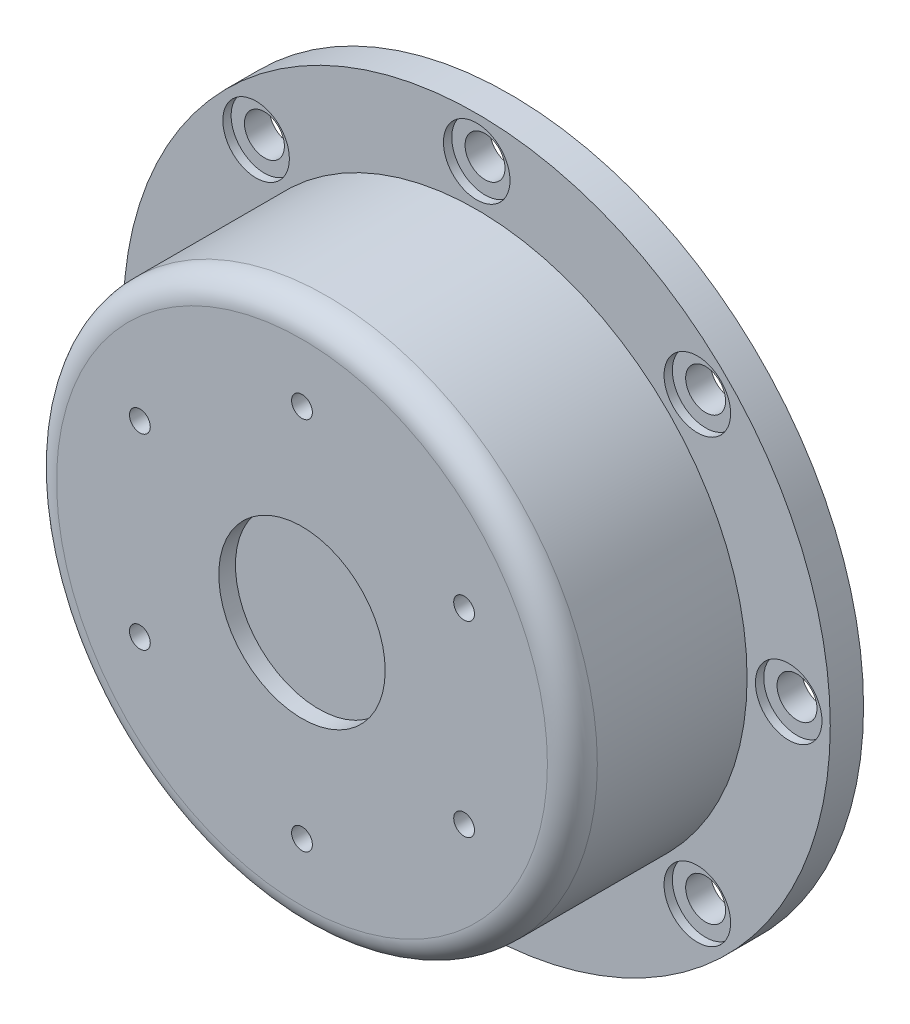
from build123d import *

# Parameters (mm, degrees)
SKETCH_1_R               = 42.5
EXTRUDE_1_DEPTH          = 25
SKETCH_2_OUTSIDE_W       = 111.556
SKETCH_2_OUTSIDE_H       = 111.556
SKETCH_2_OUTSIDE_R       = 32.5
CUT_EXTRUDE_1_DEPTH      = 21
PATTERN_CIRCULAR_1_COUNT = 8
SKETCH_5_R               = 10
CUT_EXTRUDE_2_DEPTH      = 2
PATTERN_CIRCULAR_2_COUNT = 6
FILLET_1_R               = 3


with BuildPart() as part:
    # 草图1 → 凸台-拉伸1 (new body)
    with BuildSketch(Plane.XY):
        Circle(SKETCH_1_R)
    extrude(amount=EXTRUDE_1_DEPTH)

    # 草图2 outside → 切除-拉伸1 (cut)
    with BuildSketch(Plane.XY.offset(25)):
        Rectangle(SKETCH_2_OUTSIDE_W, SKETCH_2_OUTSIDE_H)
        Circle(SKETCH_2_OUTSIDE_R, mode=Mode.SUBTRACT)
    extrude(amount=-CUT_EXTRUDE_1_DEPTH, mode=Mode.SUBTRACT)

    # 草图3 → 打孔尺寸(%根据)内六角圆柱头螺钉的类型1 (revolve, cut)
    with BuildSketch(Plane(origin=(0, 37.5, 4), x_dir=(0, -1, 0), z_dir=(1, 0, 0))):
        Polygon((0, 0), (0, 7.942065486), (2.4, 6.5), (2.4, 1), (4, 1), (4, 0), align=None)
    hole_wizard_1 = revolve(axis=Axis((0, 37.5, 10.35), (0, 0, -1)), mode=Mode.SUBTRACT)

    # 阵列(圆周)1: 打孔尺寸(%根据)内六角圆柱头螺钉的类型1 ×8 about axis
    pattern_circular_1_axis = Axis((0, 0, 0), (0, 0, 1))
    for i in range(1, PATTERN_CIRCULAR_1_COUNT):
        add(hole_wizard_1.rotate(pattern_circular_1_axis, i * 360 / PATTERN_CIRCULAR_1_COUNT), mode=Mode.SUBTRACT)

    # 草图5 → 切除-拉伸2 (cut)
    with BuildSketch(Plane.XY.offset(25)):
        Circle(SKETCH_5_R)
    extrude(amount=-CUT_EXTRUDE_2_DEPTH, mode=Mode.SUBTRACT)

    # 草图6 → M3 螺纹孔1 (revolve, cut)
    with BuildSketch(Plane(origin=(0, 22.5, 25), x_dir=(0, -1, 0), z_dir=(1, 0, 0))):
        Polygon((0, 0), (0, 7.251075774), (1.25, 6.5), (1.25, 0), align=None)
    hole_wizard_m3_1 = revolve(axis=Axis((0, 22.5, 31.35), (0, 0, -1)), mode=Mode.SUBTRACT)

    # 阵列(圆周)2: M3 螺纹孔1 ×6 about axis
    pattern_circular_2_axis = Axis((0, 0, 0), (0, 0, 1))
    for i in range(1, PATTERN_CIRCULAR_2_COUNT):
        add(hole_wizard_m3_1.rotate(pattern_circular_2_axis, i * 360 / PATTERN_CIRCULAR_2_COUNT), mode=Mode.SUBTRACT)

    # 圆角1
    fillet_1_edges = [part.edges().sort_by_distance(p)[0] for p in [
        (-32.5, 0, 25),
    ]]
    fillet(fillet_1_edges, radius=FILLET_1_R)


solid = part.part
